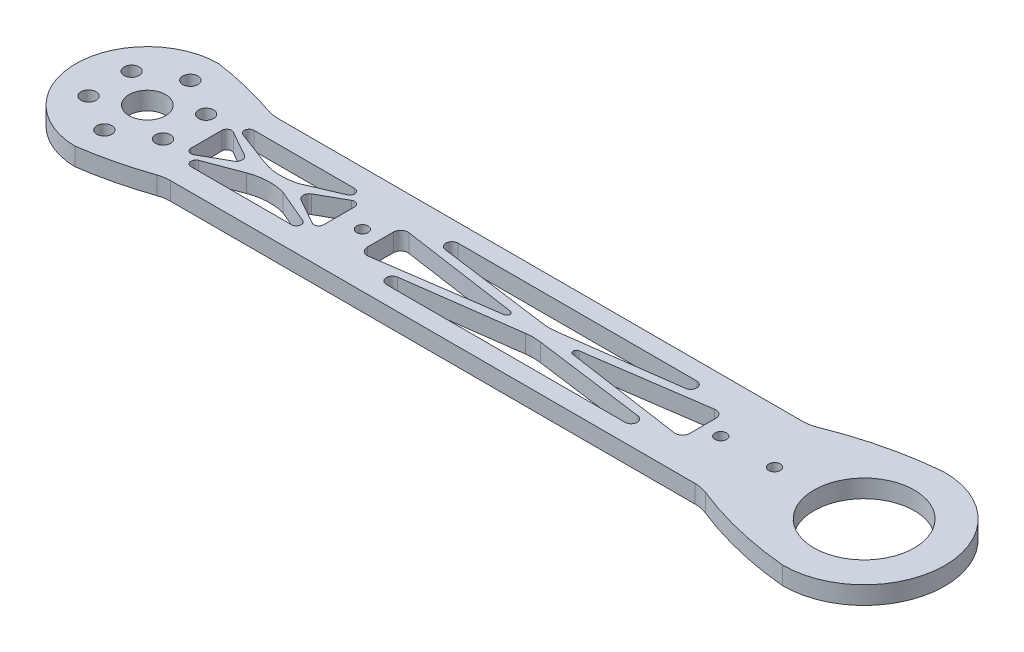
from build123d import *

# Parameters (mm, degrees)
EXTRUDE_1_DEPTH     = 5
SKETCH_2_R          = 5.1
CUT_EXTRUDE_1_DEPTH = 10
SKETCH_3_R          = 14
CUT_EXTRUDE_2_DEPTH = 10
SKETCH_4_R          = 2.1
CUT_EXTRUDE_3_DEPTH = 10
CUT_EXTRUDE_4_DEPTH = 224.690634583
FILLET_1_R          = 10
SKETCH_12_R         = 1.6
CUT_EXTRUDE_5_DEPTH = 224.690634583
CUT_EXTRUDE_6_DEPTH = 10


with BuildPart() as part:
    # 草图1 → 凸台-拉伸1 (new body)
    with BuildSketch(Plane(origin=(0, 0, 0), x_dir=(1, 0, 0), z_dir=(0, 1, 0))):
        with BuildLine():
            Line((-0.25, 19.998437439), (199.71875, 22.498242119))
            ThreePointArc((199.71875, 22.498242119), (222.5, 0), (199.71875, -22.498242119))
            Line((199.71875, -22.498242119), (-0.25, -19.998437439))
            ThreePointArc((-0.25, -19.998437439), (-20, 0), (-0.25, 19.998437439))
        make_face()
    extrude(amount=EXTRUDE_1_DEPTH)

    # 草图2 → 切除-拉伸1 (cut)
    with BuildSketch(Plane(origin=(0, 5, 0), x_dir=(1, 0, 0), z_dir=(0, 1, 0))):
        with Locations(Location((0, 0, 0), (0, 0, 270))):
            Circle(SKETCH_2_R)
    extrude(amount=-CUT_EXTRUDE_1_DEPTH, mode=Mode.SUBTRACT)

    # 草图3 → 切除-拉伸2 (cut)
    with BuildSketch(Plane(origin=(0, 5, 0), x_dir=(1, 0, 0), z_dir=(0, 1, 0))):
        with Locations(Location((200, 0, 0), (0, 0, 270))):
            Circle(SKETCH_3_R)
    extrude(amount=-CUT_EXTRUDE_2_DEPTH, mode=Mode.SUBTRACT)

    # 草图4 → 切除-拉伸3 (cut)
    with BuildSketch(Plane(origin=(0, 5, 0), x_dir=(1, 0, 0), z_dir=(0, 1, 0))):
        with Locations(Location((0, 12, 0), (0, 0, 270))):
            Circle(SKETCH_4_R)
        with Locations(Location((10.392304845, 6, 0), (0, 0, 270))):
            Circle(SKETCH_4_R)
        with Locations(Location((10.392304845, -6, 0), (0, 0, 270))):
            Circle(SKETCH_4_R)
        with Locations(Location((0, -12, 0), (0, 0, 270))):
            Circle(SKETCH_4_R)
        with Locations(Location((-10.392304845, -6, 0), (0, 0, 270))):
            Circle(SKETCH_4_R)
        with Locations(Location((-10.392304845, 6, 0), (0, 0, 270))):
            Circle(SKETCH_4_R)
    extrude(amount=-CUT_EXTRUDE_3_DEPTH, mode=Mode.SUBTRACT)

    # 草图10 → 切除-拉伸4 (cut, through all)
    with BuildSketch(Plane(origin=(0, 5, 0), x_dir=(1, 0, 0), z_dir=(0, 1, 0))):
        with BuildLine():
            Line((19.75, 15), (169.71875, 15))
            ThreePointArc((169.71875, 15), (184.427162899, 19.915742901), (199.71875, 22.498242119))
            Line((199.71875, 22.498242119), (-0.25, 19.998437439))
            ThreePointArc((-0.25, 19.998437439), (9.879148371, 18.015973695), (19.75, 15))
        make_face()
        with BuildLine():
            Line((19.75, -15), (169.71875, -15))
            ThreePointArc((169.71875, -15), (184.427162899, -19.915742901), (199.71875, -22.498242119))
            Line((199.71875, -22.498242119), (-0.25, -19.998437439))
            ThreePointArc((-0.25, -19.998437439), (9.879148371, -18.015973695), (19.75, -15))
        make_face()
    extrude(amount=-CUT_EXTRUDE_4_DEPTH, mode=Mode.SUBTRACT)

    # 圆角1
    fillet_1_edges = [part.edges().sort_by_distance(p)[0] for p in [
        (169.71875, 2.5, 15),
        (19.75, 2.5, 15),
        (19.75, 2.5, -15),
        (169.71875, 2.5, -15),
    ]]
    fillet(fillet_1_edges, radius=FILLET_1_R)

    # 草图12 → 切除-拉伸5 (cut, through all)
    with BuildSketch(Plane(origin=(0, 5, 0), x_dir=(1, 0, 0), z_dir=(0, 1, 0))):
        with Locations(Location((160, 0, 0), (0, 0, 270))):
            Circle(SKETCH_12_R)
        with Locations(Location((60, 0, 0), (0, 0, 270))):
            Circle(SKETCH_12_R)
        with Locations(Location((175, 0, 0), (0, 0, 270))):
            Circle(SKETCH_12_R)
        with BuildLine():
            Line((76.690146779, 10), (143.309853221, 10))
            ThreePointArc((143.309853221, 10), (144.993003562, 8.426306348), (143.535868598, 6.64129529))
            Line((143.535868598, 6.64129529), (112.102965186, 2.39880546))
            ThreePointArc((112.102965186, 2.39880546), (109.999758761, 2.251989281), (107.896074318, 2.391789195))
            Line((107.896074318, 2.391789195), (76.464131402, 6.64129529))
            ThreePointArc((76.464131402, 6.64129529), (75.006996438, 8.426306348), (76.690146779, 10))
        make_face()
        with BuildLine():
            Line((65, 3.615503909), (65, -3.615503909))
            ThreePointArc((65, -3.615503909), (65.713191903, -5.175920839), (67.359810975, -5.657781105))
            Line((67.359810975, -5.657781105), (100.428751598, -0.862135837))
            ThreePointArc((100.428751598, -0.862135837), (101.174879309, 0), (100.428751598, 0.862135837))
            Line((100.428751598, 0.862135837), (67.359810975, 5.657781105))
            ThreePointArc((67.359810975, 5.657781105), (65.713191903, 5.175920839), (65, 3.615503909))
        make_face()
        with BuildLine():
            Line((155, 3.615503909), (155, -3.615503909))
            ThreePointArc((155, -3.615503909), (154.286808097, -5.175920839), (152.640189025, -5.657781105))
            Line((152.640189025, -5.657781105), (119.571248402, -0.862135837))
            ThreePointArc((119.571248402, -0.862135837), (118.825120691, 0), (119.571248402, 0.862135837))
            Line((119.571248402, 0.862135837), (152.640189025, 5.657781105))
            ThreePointArc((152.640189025, 5.657781105), (154.286808097, 5.175920839), (155, 3.615503909))
        make_face()
        with BuildLine():
            Line((76.464131402, -6.64129529), (107.896074318, -2.391789195))
            ThreePointArc((107.896074318, -2.391789195), (109.999758761, -2.251989281), (112.102965186, -2.39880546))
            Line((112.102965186, -2.39880546), (143.535868598, -6.64129529))
            ThreePointArc((143.535868598, -6.64129529), (144.993003562, -8.426306348), (143.309853221, -10))
            Line((143.309853221, -10), (76.690146779, -10))
            ThreePointArc((76.690146779, -10), (75.006996438, -8.426306348), (76.464131402, -6.64129529))
        make_face()
    extrude(amount=-CUT_EXTRUDE_5_DEPTH, mode=Mode.SUBTRACT)

    # 草图13 → 切除-拉伸6 (cut)
    with BuildSketch(Plane(origin=(0, 5, 0), x_dir=(1, 0, 0), z_dir=(0, 1, 0))):
        with BuildLine():
            Line((20.970819312, 8.785118289), (49.029180688, 8.785118289))
            ThreePointArc((49.029180688, 8.785118289), (50.351263939, 7.681791354), (49.502305324, 6.183624568))
            Line((49.502305324, 6.183624568), (39.957431091, 2.113629648))
            ThreePointArc((39.957431091, 2.113629648), (35.035801099, 1.547966117), (30.182224549, 2.540544414))
            Line((30.182224549, 2.540544414), (20.497694676, 6.183624568))
            ThreePointArc((20.497694676, 6.183624568), (19.648736061, 7.681791354), (20.970819312, 8.785118289))
        make_face()
        with BuildLine():
            Line((16.490400657, 4.317991857), (16.490400657, -4.317991857))
            ThreePointArc((16.490400657, -4.317991857), (17.156548552, -5.478408553), (18.494540137, -5.488330518))
            Line((18.494540137, -5.488330518), (25.642155827, -1.455347803))
            ThreePointArc((25.642155827, -1.455347803), (26.492021725, 0), (25.642155827, 1.455347803))
            Line((25.642155827, 1.455347803), (18.494540137, 5.488330518))
            ThreePointArc((18.494540137, 5.488330518), (17.156548552, 5.478408553), (16.490400657, 4.317991857))
        make_face()
        with BuildLine():
            Line((53.509599343, 4.317991857), (53.509599343, -4.317991857))
            ThreePointArc((53.509599343, -4.317991857), (52.843451448, -5.478408553), (51.505459863, -5.488330518))
            Line((51.505459863, -5.488330518), (44.357844173, -1.455347803))
            ThreePointArc((44.357844173, -1.455347803), (43.507978275, 0), (44.357844173, 1.455347803))
            Line((44.357844173, 1.455347803), (51.505459863, 5.488330518))
            ThreePointArc((51.505459863, 5.488330518), (52.843451448, 5.478408553), (53.509599343, 4.317991857))
        make_face()
        with BuildLine():
            Line((20.497694676, -6.183624568), (30.182224549, -2.540544414))
            ThreePointArc((30.182224549, -2.540544414), (35.035801099, -1.547966117), (39.957431091, -2.113629648))
            Line((39.957431091, -2.113629648), (49.502305324, -6.183624568))
            ThreePointArc((49.502305324, -6.183624568), (50.351263939, -7.681791354), (49.029180688, -8.785118289))
            Line((49.029180688, -8.785118289), (20.970819312, -8.785118289))
            ThreePointArc((20.970819312, -8.785118289), (19.648736061, -7.681791354), (20.497694676, -6.183624568))
        make_face()
    extrude(amount=-CUT_EXTRUDE_6_DEPTH, mode=Mode.SUBTRACT)


solid = part.part
